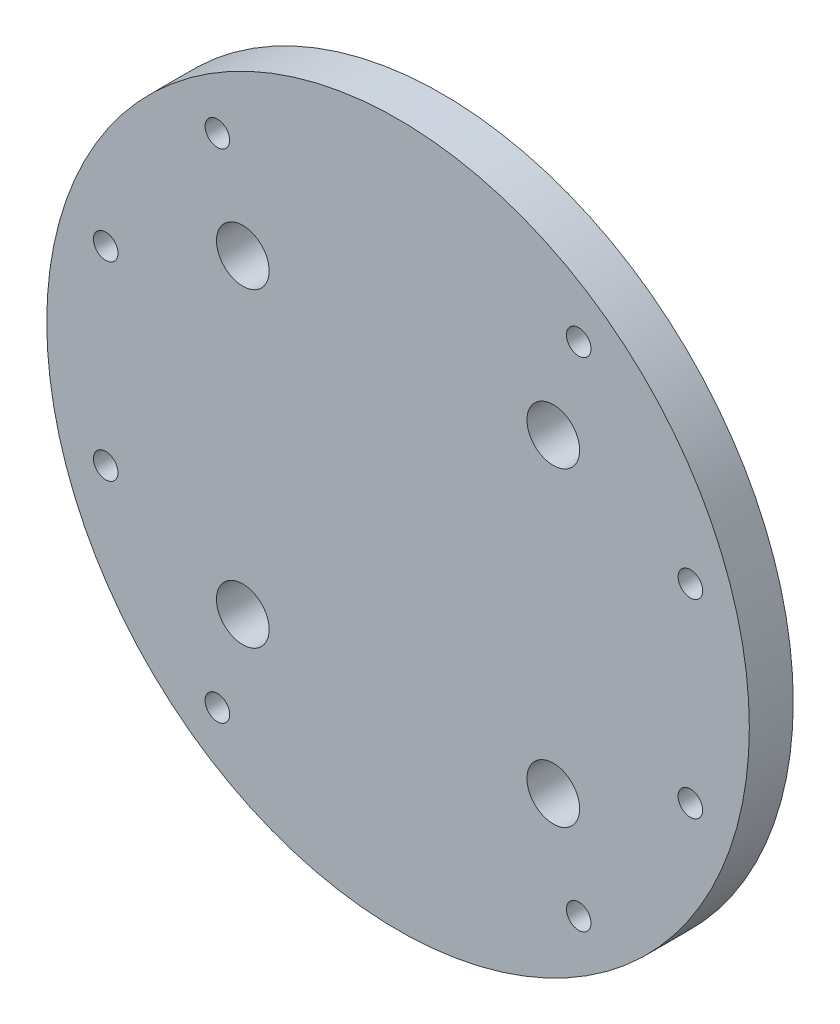
from build123d import *

# Parameters (mm, degrees)
SKETCH1_R           = 40
BOSS_EXTRUDE1_DEPTH = 5
SKETCH1_5_R         = 3
CUT_EXTRUDE3_DEPTH  = 5
SKETCH1_8_R         = 15.5
BOSS_EXTRUDE2_DEPTH = 6
CHAMFER1_SIZE       = 1
SKETCH1_20_R        = 1.4
CUT_EXTRUDE12_DEPTH = 7
SKETCH1_22_R        = 2.75
CUT_EXTRUDE13_DEPTH = 3


with BuildPart() as part:
    # Sketch1 → Boss-Extrude1 (new body)
    with BuildSketch(Plane.XY):
        Circle(SKETCH1_R)
    extrude(amount=BOSS_EXTRUDE1_DEPTH)

    # Sketch1<5> → Cut-Extrude3 (cut)
    with BuildSketch(Plane.XY):
        with Locations((17.67766953, 17.67766953)):
            Circle(SKETCH1_5_R)
        with Locations((17.67766953, -17.67766953)):
            Circle(SKETCH1_5_R)
        with Locations((-17.67766953, -17.67766953)):
            Circle(SKETCH1_5_R)
        with Locations((-17.67766953, 17.67766953)):
            Circle(SKETCH1_5_R)
    extrude(amount=CUT_EXTRUDE3_DEPTH, mode=Mode.SUBTRACT)

    # Sketch1<8> → Boss-Extrude2 (add)
    with BuildSketch(Plane.XY):
        Circle(SKETCH1_8_R)
    extrude(amount=-BOSS_EXTRUDE2_DEPTH)

    # Chamfer1
    chamfer1_edges = [part.edges().sort_by_distance(p)[0] for p in [
        (-15.5, 0, -6),
    ]]
    chamfer(chamfer1_edges, length=CHAMFER1_SIZE)

    # Sketch1<20> → Cut-Extrude12 (cut)
    with BuildSketch(Plane.XY):
        with Locations((20.57248383, 28.315594803)):
            Circle(SKETCH1_20_R)
        with Locations((33.28697807, 10.815594803)):
            Circle(SKETCH1_20_R)
        with Locations((33.28697807, -10.815594803)):
            Circle(SKETCH1_20_R)
        with Locations((20.57248383, -28.315594803)):
            Circle(SKETCH1_20_R)
        with Locations((-20.57248383, -28.315594803)):
            Circle(SKETCH1_20_R)
        with Locations((-33.28697807, -10.815594803)):
            Circle(SKETCH1_20_R)
        with Locations((-33.28697807, 10.815594803)):
            Circle(SKETCH1_20_R)
        with Locations((-20.57248383, 28.315594803)):
            Circle(SKETCH1_20_R)
    extrude(amount=CUT_EXTRUDE12_DEPTH, mode=Mode.SUBTRACT)

    # Sketch1<22> → Cut-Extrude13 (cut)
    with BuildSketch(Plane.XY):
        with Locations((20.57248383, 28.315594803)):
            Circle(SKETCH1_22_R)
        with Locations((33.28697807, 10.815594803)):
            Circle(SKETCH1_22_R)
        with Locations((33.28697807, -10.815594803)):
            Circle(SKETCH1_22_R)
        with Locations((20.57248383, -28.315594803)):
            Circle(SKETCH1_22_R)
        with Locations((-20.57248383, -28.315594803)):
            Circle(SKETCH1_22_R)
        with Locations((-33.28697807, -10.815594803)):
            Circle(SKETCH1_22_R)
        with Locations((-33.28697807, 10.815594803)):
            Circle(SKETCH1_22_R)
        with Locations((-20.57248383, 28.315594803)):
            Circle(SKETCH1_22_R)
    extrude(amount=CUT_EXTRUDE13_DEPTH, mode=Mode.SUBTRACT)


solid = part.part
